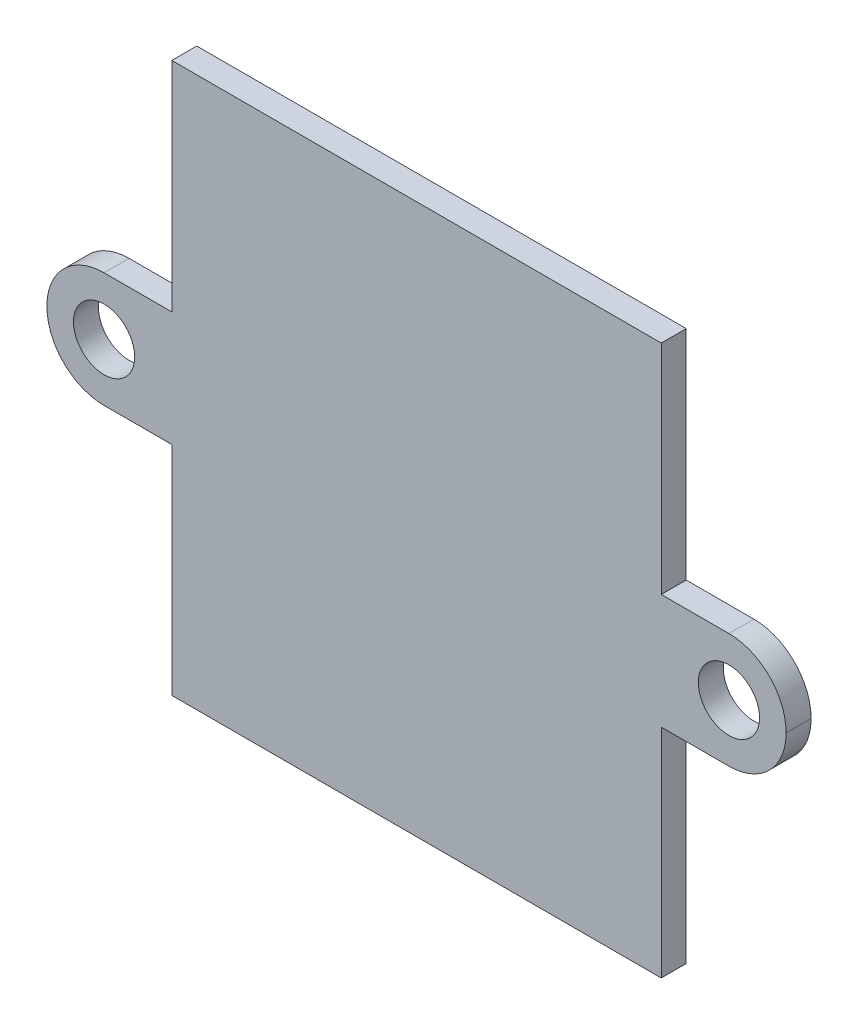
from build123d import *

# Parameters (mm, degrees)
SZKIC1_R                    = 1.225
DODANIE_WYCI_GNI_CIE1_DEPTH = 1


with BuildPart() as part:
    # Szkic1 → Dodanie-wyciągnięcie1 (new body)
    with BuildSketch(Plane.XY):
        with BuildLine():
            Line((-7.587614458, 10.373277108), (12.012385542, 10.373277108))
            Line((12.012385542, 10.373277108), (12.012385542, 1.653277108))
            Line((12.012385542, 1.653277108), (14.722385542, 1.653277108))
            ThreePointArc((14.722385542, 1.653277108), (16.341660071, 0.982551637), (17.012385542, -0.636722892))
            Line((17.012385542, -0.636722892), (17.012385542, -0.656722892))
            ThreePointArc((17.012385542, -0.656722892), (16.341660071, -2.27599742), (14.722385542, -2.946722892))
            Line((14.722385542, -2.946722892), (12.012385542, -2.946722892))
            Line((12.012385542, -2.946722892), (12.012385542, -11.646722892))
            Line((12.012385542, -11.646722892), (-7.587614458, -11.646722892))
            Line((-7.587614458, -11.646722892), (-7.587614458, -2.946722892))
            Line((-7.587614458, -2.946722892), (-10.297614458, -2.946722892))
            ThreePointArc((-10.297614458, -2.946722892), (-11.916888987, -2.27599742), (-12.587614458, -0.656722892))
            Line((-12.587614458, -0.656722892), (-12.587614458, -0.636722892))
            ThreePointArc((-12.587614458, -0.636722892), (-11.916888987, 0.982551637), (-10.297614458, 1.653277108))
            Line((-10.297614458, 1.653277108), (-7.587614458, 1.653277108))
            Line((-7.587614458, 1.653277108), (-7.587614458, 10.373277108))
        make_face()
        with Locations((14.722385542, -0.656722892)):
            Circle(SZKIC1_R, mode=Mode.SUBTRACT)
        with Locations(Location((-10.297614458, -0.656722892, 0), (0, 0, 180))):
            Circle(SZKIC1_R, mode=Mode.SUBTRACT)
    extrude(amount=DODANIE_WYCI_GNI_CIE1_DEPTH)


solid = part.part
